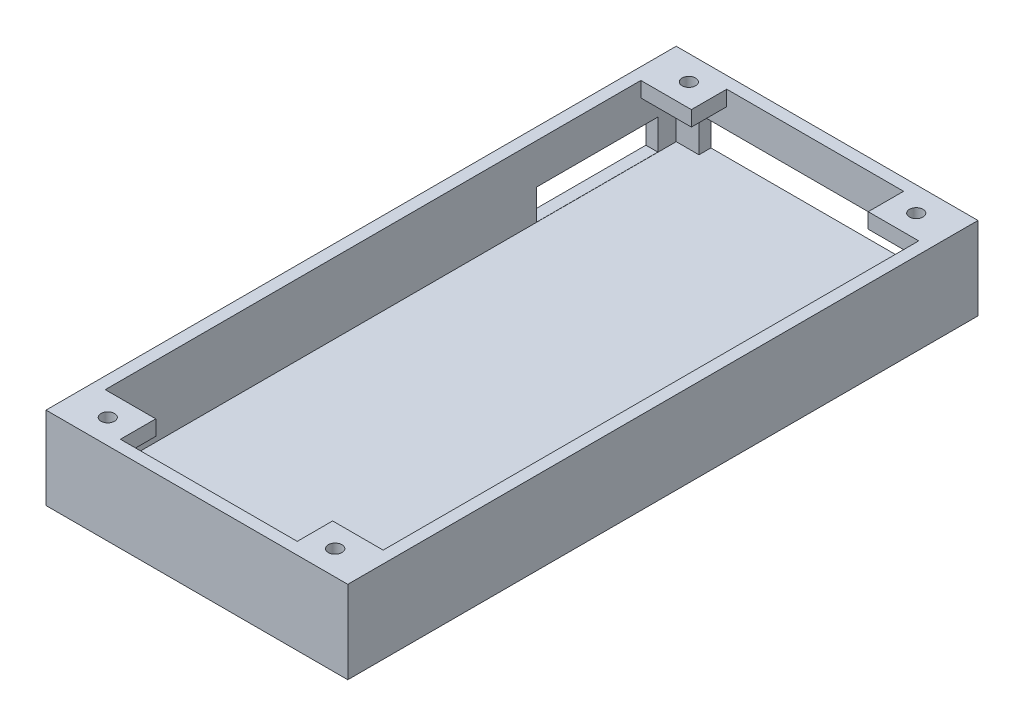
from build123d import *

# Parameters (mm, degrees)
SKETCH1_W           = 75.85
SKETCH1_H           = 158.4
BOSS_EXTRUDE1_DEPTH = 3
SKETCH2_W           = 75.85
SKETCH2_H           = 158.4
SKETCH2_W_2         = 69.85
SKETCH2_H_2         = 152.4
BOSS_EXTRUDE2_DEPTH = 17.78
SKETCH3_W           = 12.7
SKETCH3_H           = 8.89
BOSS_EXTRUDE3_DEPTH = 3.81
CUT_EXTRUDE4_REACH  = 92.237
SKETCH4_R           = 1.7
SKETCH4_R_2         = 1.72
CUT_EXTRUDE5_REACH  = 166.197
SKETCH10_W          = 58.42
SKETCH10_H          = 8.89
CUT_EXTRUDE6_REACH  = 113.614
SKETCH11_W          = 30.48
SKETCH11_H          = 7.62
SKETCH12_W          = 17.78
SKETCH12_H          = 5.08
BOSS_EXTRUDE4_DEPTH = 5.08
SKETCH13_W          = 17.78
SKETCH13_H          = 2.54
BOSS_EXTRUDE5_DEPTH = 5.08


with BuildPart() as part:
    # Sketch1 → Boss-Extrude1 (new body)
    with BuildSketch(Plane(origin=(0, 0, 0), x_dir=(1, 0, 0), z_dir=(0, 1, 0))):
        Rectangle(SKETCH1_W, SKETCH1_H)
    extrude(amount=BOSS_EXTRUDE1_DEPTH)

    # Sketch2 → Boss-Extrude2 (add)
    with BuildSketch(Plane(origin=(0, 3, 0), x_dir=(1, 0, 0), z_dir=(0, 1, 0))):
        Rectangle(SKETCH2_W, SKETCH2_H)
        Rectangle(SKETCH2_W_2, SKETCH2_H_2, mode=Mode.SUBTRACT)
    extrude(amount=BOSS_EXTRUDE2_DEPTH)

    # Sketch3 → Boss-Extrude3 (add)
    with BuildSketch(Plane(origin=(0, 20.78, 0), x_dir=(1, 0, 0), z_dir=(0, 1, 0))):
        with Locations((-28.575, 71.755)):
            Rectangle(SKETCH3_W, SKETCH3_H)
        with Locations((-28.575, -71.755)):
            Rectangle(SKETCH3_W, SKETCH3_H)
        with Locations((28.575, 71.755)):
            Rectangle(SKETCH3_W, SKETCH3_H)
        with Locations((28.575, -71.755)):
            Rectangle(SKETCH3_W, SKETCH3_H)
    extrude(amount=-BOSS_EXTRUDE3_DEPTH)

    # Sketch4 → Cut-Extrude4 (cut, up to next)
    with BuildSketch(Plane(origin=(0, 20.78, 0), x_dir=(1, 0, 0), z_dir=(0, 1, 0)), mode=Mode.PRIVATE) as cut_extrude4_sk1:
        with Locations(Location((-28.575, 73.025, 0), (0, 0, 270))):
            Circle(SKETCH4_R)
    cut_extrude4_tool1 = extrude(cut_extrude4_sk1.sketch, amount=-CUT_EXTRUDE4_REACH, mode=Mode.PRIVATE) & part.part
    # Sketch4 → Cut-Extrude4 (cut, up to next)
    with BuildSketch(Plane(origin=(0, 20.78, 0), x_dir=(1, 0, 0), z_dir=(0, 1, 0)), mode=Mode.PRIVATE) as cut_extrude4_sk2:
        with Locations(Location((28.575, 73.025, 0), (0, 0, 270))):
            Circle(SKETCH4_R)
    cut_extrude4_tool2 = extrude(cut_extrude4_sk2.sketch, amount=-CUT_EXTRUDE4_REACH, mode=Mode.PRIVATE) & part.part
    # Sketch4 → Cut-Extrude4 (cut, up to next)
    with BuildSketch(Plane(origin=(0, 20.78, 0), x_dir=(1, 0, 0), z_dir=(0, 1, 0)), mode=Mode.PRIVATE) as cut_extrude4_sk3:
        with Locations(Location((28.575, -73.025, 0), (0, 0, 270))):
            Circle(SKETCH4_R_2)
    cut_extrude4_tool3 = extrude(cut_extrude4_sk3.sketch, amount=-CUT_EXTRUDE4_REACH, mode=Mode.PRIVATE) & part.part
    # Sketch4 → Cut-Extrude4 (cut, up to next)
    with BuildSketch(Plane(origin=(0, 20.78, 0), x_dir=(1, 0, 0), z_dir=(0, 1, 0)), mode=Mode.PRIVATE) as cut_extrude4_sk4:
        with Locations(Location((-28.575, -73.025, 0), (0, 0, 270))):
            Circle(SKETCH4_R)
    cut_extrude4_tool4 = extrude(cut_extrude4_sk4.sketch, amount=-CUT_EXTRUDE4_REACH, mode=Mode.PRIVATE) & part.part
    add(cut_extrude4_tool1.solids().sort_by_distance((-28.575, 20.78, -73.025))[0], mode=Mode.SUBTRACT)
    add(cut_extrude4_tool2.solids().sort_by_distance((28.575, 20.78, -73.025))[0], mode=Mode.SUBTRACT)
    add(cut_extrude4_tool3.solids().sort_by_distance((28.575, 20.78, 73.025))[0], mode=Mode.SUBTRACT)
    add(cut_extrude4_tool4.solids().sort_by_distance((-28.575, 20.78, 73.025))[0], mode=Mode.SUBTRACT)

    # Sketch10 → Cut-Extrude5 (cut, up to next)
    with BuildSketch(Plane(origin=(0, 0, -79.2), x_dir=(-1, 0, 0), z_dir=(0, 0, -1)), mode=Mode.PRIVATE) as cut_extrude5_sk1:
        with Locations((0, 7.445)):
            Rectangle(SKETCH10_W, SKETCH10_H)
    cut_extrude5_tool1 = extrude(cut_extrude5_sk1.sketch, amount=-CUT_EXTRUDE5_REACH, mode=Mode.PRIVATE) & part.part
    add(cut_extrude5_tool1.solids().sort_by_distance((0, 7.445, -79.2))[0], mode=Mode.SUBTRACT)

    # Sketch11 → Cut-Extrude6 (cut, up to next)
    with BuildSketch(Plane.ZY.offset(37.925), mode=Mode.PRIVATE) as cut_extrude6_sk1:
        with Locations((-56.34, 6.858)):
            Rectangle(SKETCH11_W, SKETCH11_H)
    cut_extrude6_tool1 = extrude(cut_extrude6_sk1.sketch, amount=-CUT_EXTRUDE6_REACH, mode=Mode.PRIVATE) & part.part
    add(cut_extrude6_tool1.solids().sort_by_distance((-37.925, 6.858, -56.34))[0], mode=Mode.SUBTRACT)

    # Sketch12 → Boss-Extrude4 (add)
    with BuildSketch(Plane.XZ):
        with Locations((0, 12.7)):
            Rectangle(SKETCH12_W, SKETCH12_H)
        with Locations((0, -12.7)):
            Rectangle(SKETCH12_W, SKETCH12_H)
    extrude(amount=BOSS_EXTRUDE4_DEPTH)

    # Sketch13 → Boss-Extrude5 (add)
    with BuildSketch(Plane(origin=(0, 0, 10.16), x_dir=(-1, 0, 0), z_dir=(0, 0, -1))):
        with Locations((0, -3.81)):
            Rectangle(SKETCH13_W, SKETCH13_H)
    boss_extrude5 = extrude(amount=BOSS_EXTRUDE5_DEPTH)

    # Mirror1: Boss-Extrude5 across plane
    add(boss_extrude5.mirror(Plane(origin=(0, 0, 0), x_dir=(1, 0, 0), z_dir=(0, 0, -1))))


solid = part.part
